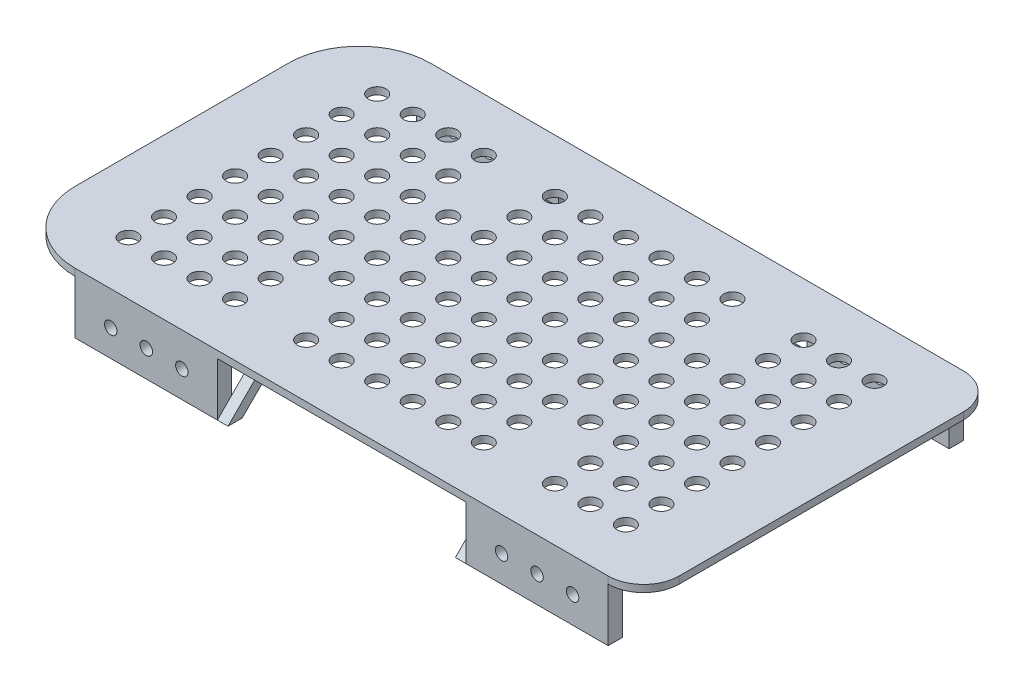
from build123d import *

# Parameters (mm, degrees)
Y_KSEKLIK_EKSTR_ZYON1_DEPTH = 2
IZIM3_W                     = 40
IZIM3_H                     = 4
Y_KSEKLIK_EKSTR_ZYON2_DEPTH = 15
Y_KSEKLIK_EKSTR_ZYON3_DEPTH = 3
Y_KSEKLIK_EKSTR_ZYON4_DEPTH = 3
IZIM6_R                     = 1.75
KES_EKSTR_ZYON1_DEPTH       = 101
IZIM7_R                     = 2.5
KES_EKSTR_ZYON2_DEPTH       = 2


with BuildPart() as part:
    # Çizim1 → Yükseklik-Ekstrüzyon1 (new body)
    with BuildSketch(Plane(origin=(0, 0, 0), x_dir=(1, 0, 0), z_dir=(0, 1, 0))):
        with BuildLine():
            Line((-70, -50), (80, -50))
            ThreePointArc((80, -50), (87.071067812, -47.071067812), (90, -40))
            Line((90, -40), (90, 40))
            ThreePointArc((90, 40), (87.071067812, 47.071067812), (80, 50))
            Line((80, 50), (-70, 50))
            ThreePointArc((-70, 50), (-84.142135624, 44.142135624), (-90, 30))
            Line((-90, 30), (-90, -30))
            ThreePointArc((-90, -30), (-84.142135624, -44.142135624), (-70, -50))
        make_face()
    extrude(amount=Y_KSEKLIK_EKSTR_ZYON1_DEPTH)

    # Çizim3 → Yükseklik-Ekstrüzyon2 (add)
    with BuildSketch(Plane.XZ):
        with Locations((-50, 48)):
            Rectangle(IZIM3_W, IZIM3_H)
        with Locations((60, 48)):
            Rectangle(IZIM3_W, IZIM3_H)
        with Locations((-50, -48)):
            Rectangle(IZIM3_W, IZIM3_H)
        with Locations((60, -48)):
            Rectangle(IZIM3_W, IZIM3_H)
    extrude(amount=Y_KSEKLIK_EKSTR_ZYON2_DEPTH)

    # Çizim4 → Yükseklik-Ekstrüzyon3 (add)
    with BuildSketch(Plane(origin=(-30, 0, 0), x_dir=(0, 0, -1), z_dir=(1, 0, 0))):
        Polygon((50, -15), (46, -15), (31, 0), (35, 0), align=None)
        Polygon((-35, 0), (-50, -15), (-46, -15), (-31, 0), align=None)
    extrude(amount=Y_KSEKLIK_EKSTR_ZYON3_DEPTH)

    # Çizim5 → Yükseklik-Ekstrüzyon4 (add)
    with BuildSketch(Plane.ZY.offset(-40)):
        Polygon((-50, -15), (-46, -15), (-31, 0), (-35, 0), align=None)
        Polygon((35, 0), (50, -15), (46, -15), (31, 0), align=None)
    extrude(amount=Y_KSEKLIK_EKSTR_ZYON4_DEPTH)

    # Çizim6 → Kes-Ekstrüzyon1 (cut)
    with BuildSketch(Plane.XY.offset(50)):
        with Locations((-60, -7.5)):
            Circle(IZIM6_R)
        with Locations((-50, -7.5)):
            Circle(IZIM6_R)
        with Locations((-40, -7.5)):
            Circle(IZIM6_R)
        with Locations((50, -7.5)):
            Circle(IZIM6_R)
        with Locations((60, -7.5)):
            Circle(IZIM6_R)
        with Locations((70, -7.5)):
            Circle(IZIM6_R)
    extrude(amount=-KES_EKSTR_ZYON1_DEPTH, mode=Mode.SUBTRACT)

    # Çizim7 → Kes-Ekstrüzyon2 (cut)
    with BuildSketch(Plane(origin=(0, 2, 0), x_dir=(1, 0, 0), z_dir=(0, 1, 0))):
        with Locations(Location((-70, 35, 0), (0, 0, 270))):
            Circle(IZIM7_R)
        with Locations(Location((-70, 25, 0), (0, 0, 270))):
            Circle(IZIM7_R)
        with Locations(Location((-70, 15, 0), (0, 0, 270))):
            Circle(IZIM7_R)
        with Locations(Location((-70, 5, 0), (0, 0, 270))):
            Circle(IZIM7_R)
        with Locations(Location((-70, -5, 0), (0, 0, 270))):
            Circle(IZIM7_R)
        with Locations(Location((-70, -15, 0), (0, 0, 270))):
            Circle(IZIM7_R)
        with Locations(Location((-70, -25, 0), (0, 0, 270))):
            Circle(IZIM7_R)
        with Locations(Location((-70, -35, 0), (0, 0, 270))):
            Circle(IZIM7_R)
        with Locations(Location((-60, -35, 0), (0, 0, 90))):
            Circle(IZIM7_R)
        with Locations(Location((-60, -25, 0), (0, 0, 90))):
            Circle(IZIM7_R)
        with Locations(Location((-60, -15, 0), (0, 0, 90))):
            Circle(IZIM7_R)
        with Locations(Location((-60, -5, 0), (0, 0, 90))):
            Circle(IZIM7_R)
        with Locations(Location((-60, 5, 0), (0, 0, 90))):
            Circle(IZIM7_R)
        with Locations(Location((-60, 15, 0), (0, 0, 90))):
            Circle(IZIM7_R)
        with Locations(Location((-60, 25, 0), (0, 0, 90))):
            Circle(IZIM7_R)
        with Locations(Location((-60, 35, 0), (0, 0, 90))):
            Circle(IZIM7_R)
        with Locations(Location((-50, 35, 0), (0, 0, 270))):
            Circle(IZIM7_R)
        with Locations(Location((-50, 25, 0), (0, 0, 270))):
            Circle(IZIM7_R)
        with Locations(Location((-50, 15, 0), (0, 0, 270))):
            Circle(IZIM7_R)
        with Locations(Location((-50, 5, 0), (0, 0, 270))):
            Circle(IZIM7_R)
        with Locations(Location((-50, -5, 0), (0, 0, 270))):
            Circle(IZIM7_R)
        with Locations(Location((-50, -15, 0), (0, 0, 270))):
            Circle(IZIM7_R)
        with Locations(Location((-50, -25, 0), (0, 0, 270))):
            Circle(IZIM7_R)
        with Locations(Location((-50, -35, 0), (0, 0, 270))):
            Circle(IZIM7_R)
        with Locations(Location((-40, -35, 0), (0, 0, 90))):
            Circle(IZIM7_R)
        with Locations(Location((-40, -25, 0), (0, 0, 90))):
            Circle(IZIM7_R)
        with Locations(Location((-40, -15, 0), (0, 0, 90))):
            Circle(IZIM7_R)
        with Locations(Location((-40, -5, 0), (0, 0, 90))):
            Circle(IZIM7_R)
        with Locations(Location((-40, 5, 0), (0, 0, 90))):
            Circle(IZIM7_R)
        with Locations(Location((-40, 15, 0), (0, 0, 90))):
            Circle(IZIM7_R)
        with Locations(Location((-40, 25, 0), (0, 0, 90))):
            Circle(IZIM7_R)
        with Locations(Location((-40, 35, 0), (0, 0, 90))):
            Circle(IZIM7_R)
        with Locations(Location((-30, 5, 0), (0, 0, 270))):
            Circle(IZIM7_R)
        with Locations(Location((-30, -5, 0), (0, 0, 270))):
            Circle(IZIM7_R)
        with Locations(Location((-30, -15, 0), (0, 0, 270))):
            Circle(IZIM7_R)
        with Locations(Location((-20, -35, 0), (0, 0, 90))):
            Circle(IZIM7_R)
        with Locations(Location((-20, -25, 0), (0, 0, 90))):
            Circle(IZIM7_R)
        with Locations(Location((-20, -15, 0), (0, 0, 90))):
            Circle(IZIM7_R)
        with Locations(Location((-20, -5, 0), (0, 0, 90))):
            Circle(IZIM7_R)
        with Locations(Location((-20, 5, 0), (0, 0, 90))):
            Circle(IZIM7_R)
        with Locations(Location((-10, 5, 0), (0, 0, 270))):
            Circle(IZIM7_R)
        with Locations(Location((-10, -5, 0), (0, 0, 270))):
            Circle(IZIM7_R)
        with Locations(Location((-10, -15, 0), (0, 0, 270))):
            Circle(IZIM7_R)
        with Locations(Location((-10, -25, 0), (0, 0, 270))):
            Circle(IZIM7_R)
        with Locations(Location((-10, -35, 0), (0, 0, 270))):
            Circle(IZIM7_R)
        with Locations(Location((-30, 15, 0), (0, 0, 270))):
            Circle(IZIM7_R)
        with Locations(Location((-20, 15, 0), (0, 0, 90))):
            Circle(IZIM7_R)
        with Locations(Location((-20, 25, 0), (0, 0, 90))):
            Circle(IZIM7_R)
        with Locations(Location((-20, 35, 0), (0, 0, 90))):
            Circle(IZIM7_R)
        with Locations(Location((-10, 35, 0), (0, 0, 270))):
            Circle(IZIM7_R)
        with Locations(Location((-10, 25, 0), (0, 0, 270))):
            Circle(IZIM7_R)
        with Locations(Location((-10, 15, 0), (0, 0, 270))):
            Circle(IZIM7_R)
        with Locations(Location((0, 15, 0), (0, 0, 90))):
            Circle(IZIM7_R)
        with Locations(Location((0, 25, 0), (0, 0, 90))):
            Circle(IZIM7_R)
        with Locations(Location((0, 35, 0), (0, 0, 90))):
            Circle(IZIM7_R)
        with Locations(Location((10, 35, 0), (0, 0, 270))):
            Circle(IZIM7_R)
        with Locations(Location((10, 25, 0), (0, 0, 270))):
            Circle(IZIM7_R)
        with Locations(Location((10, 15, 0), (0, 0, 270))):
            Circle(IZIM7_R)
        with Locations(Location((20, 15, 0), (0, 0, 90))):
            Circle(IZIM7_R)
        with Locations(Location((20, 25, 0), (0, 0, 90))):
            Circle(IZIM7_R)
        with Locations(Location((20, 35, 0), (0, 0, 90))):
            Circle(IZIM7_R)
        with Locations(Location((0, -35, 0), (0, 0, 90))):
            Circle(IZIM7_R)
        with Locations(Location((0, -25, 0), (0, 0, 90))):
            Circle(IZIM7_R)
        with Locations(Location((0, -15, 0), (0, 0, 90))):
            Circle(IZIM7_R)
        with Locations(Location((0, -5, 0), (0, 0, 90))):
            Circle(IZIM7_R)
        with Locations(Location((0, 5, 0), (0, 0, 90))):
            Circle(IZIM7_R)
        with Locations(Location((10, 5, 0), (0, 0, 270))):
            Circle(IZIM7_R)
        with Locations(Location((10, -5, 0), (0, 0, 270))):
            Circle(IZIM7_R)
        with Locations(Location((10, -15, 0), (0, 0, 270))):
            Circle(IZIM7_R)
        with Locations(Location((10, -25, 0), (0, 0, 270))):
            Circle(IZIM7_R)
        with Locations(Location((10, -35, 0), (0, 0, 270))):
            Circle(IZIM7_R)
        with Locations(Location((20, -35, 0), (0, 0, 90))):
            Circle(IZIM7_R)
        with Locations(Location((20, -25, 0), (0, 0, 90))):
            Circle(IZIM7_R)
        with Locations(Location((20, -15, 0), (0, 0, 90))):
            Circle(IZIM7_R)
        with Locations(Location((20, -5, 0), (0, 0, 90))):
            Circle(IZIM7_R)
        with Locations(Location((20, 5, 0), (0, 0, 90))):
            Circle(IZIM7_R)
        with Locations(Location((30, 35, 0), (0, 0, 270))):
            Circle(IZIM7_R)
        with Locations(Location((30, 25, 0), (0, 0, 270))):
            Circle(IZIM7_R)
        with Locations(Location((30, 15, 0), (0, 0, 270))):
            Circle(IZIM7_R)
        with Locations(Location((30, 5, 0), (0, 0, 270))):
            Circle(IZIM7_R)
        with Locations(Location((30, -5, 0), (0, 0, 270))):
            Circle(IZIM7_R)
        with Locations(Location((30, -15, 0), (0, 0, 270))):
            Circle(IZIM7_R)
        with Locations(Location((30, -25, 0), (0, 0, 270))):
            Circle(IZIM7_R)
        with Locations(Location((30, -35, 0), (0, 0, 270))):
            Circle(IZIM7_R)
        with Locations(Location((40, -15, 0), (0, 0, 90))):
            Circle(IZIM7_R)
        with Locations(Location((40, -5, 0), (0, 0, 90))):
            Circle(IZIM7_R)
        with Locations(Location((40, 5, 0), (0, 0, 90))):
            Circle(IZIM7_R)
        with Locations(Location((40, 15, 0), (0, 0, 90))):
            Circle(IZIM7_R)
        with Locations(Location((50, 35, 0), (0, 0, 270))):
            Circle(IZIM7_R)
        with Locations(Location((50, 25, 0), (0, 0, 270))):
            Circle(IZIM7_R)
        with Locations(Location((50, 15, 0), (0, 0, 270))):
            Circle(IZIM7_R)
        with Locations(Location((50, 5, 0), (0, 0, 270))):
            Circle(IZIM7_R)
        with Locations(Location((50, -5, 0), (0, 0, 270))):
            Circle(IZIM7_R)
        with Locations(Location((50, -15, 0), (0, 0, 270))):
            Circle(IZIM7_R)
        with Locations(Location((50, -25, 0), (0, 0, 270))):
            Circle(IZIM7_R)
        with Locations(Location((50, -35, 0), (0, 0, 270))):
            Circle(IZIM7_R)
        with Locations(Location((60, -35, 0), (0, 0, 90))):
            Circle(IZIM7_R)
        with Locations(Location((60, -25, 0), (0, 0, 90))):
            Circle(IZIM7_R)
        with Locations(Location((60, -15, 0), (0, 0, 90))):
            Circle(IZIM7_R)
        with Locations(Location((60, -5, 0), (0, 0, 90))):
            Circle(IZIM7_R)
        with Locations(Location((60, 5, 0), (0, 0, 90))):
            Circle(IZIM7_R)
        with Locations(Location((60, 15, 0), (0, 0, 90))):
            Circle(IZIM7_R)
        with Locations(Location((60, 25, 0), (0, 0, 90))):
            Circle(IZIM7_R)
        with Locations(Location((60, 35, 0), (0, 0, 90))):
            Circle(IZIM7_R)
        with Locations(Location((70, 35, 0), (0, 0, 270))):
            Circle(IZIM7_R)
        with Locations(Location((70, 25, 0), (0, 0, 270))):
            Circle(IZIM7_R)
        with Locations(Location((70, 15, 0), (0, 0, 270))):
            Circle(IZIM7_R)
        with Locations(Location((70, 5, 0), (0, 0, 270))):
            Circle(IZIM7_R)
        with Locations(Location((70, -5, 0), (0, 0, 270))):
            Circle(IZIM7_R)
        with Locations(Location((70, -15, 0), (0, 0, 270))):
            Circle(IZIM7_R)
        with Locations(Location((70, -25, 0), (0, 0, 270))):
            Circle(IZIM7_R)
        with Locations(Location((70, -35, 0), (0, 0, 270))):
            Circle(IZIM7_R)
    extrude(amount=-KES_EKSTR_ZYON2_DEPTH, mode=Mode.SUBTRACT)


solid = part.part
